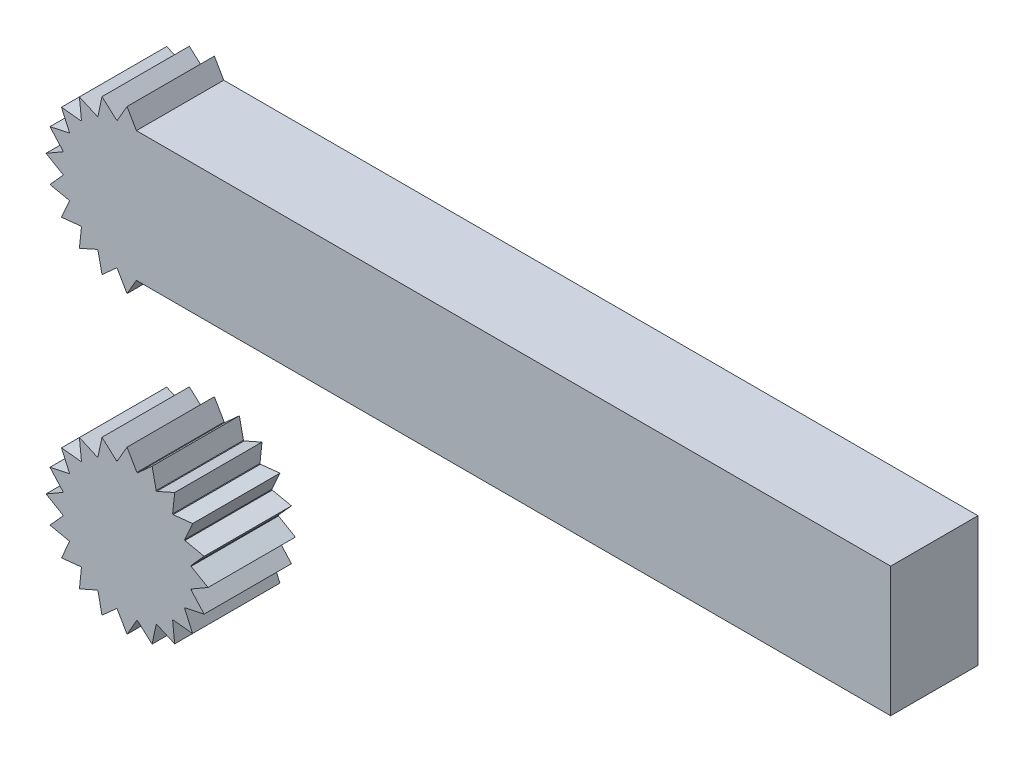
from build123d import *

# Parameters (mm, degrees)
IZIM1_W                     = 174.879
IZIM1_H                     = 29.68625
Y_KSEKLIK_EKSTR_ZYON1_DEPTH = 20
IZIM2_R                     = 14.843125
Y_KSEKLIK_EKSTR_ZYON5_DEPTH = 20


with BuildPart() as part:
    # Çizim1 → Yükseklik-Ekstrüzyon1 (new body)
    with BuildSketch(Plane.XY):
        with Locations((17.724325704, 8.366125)):
            Rectangle(IZIM1_W, IZIM1_H)
    extrude(amount=Y_KSEKLIK_EKSTR_ZYON1_DEPTH)

    # Çizim2 → Yükseklik-Ekstrüzyon5 (add, through all)
    with BuildSketch(Plane.XY.offset(20)):
        with Locations((-69.715174296, -59.190786916)):
            Circle(IZIM2_R)
        with BuildLine():
            Line((-75.450089767, -76.841041848), (-72.115481735, -73.83854729))
            ThreePointArc((-72.115481735, -73.83854729), (-74.30195217, -73.30743767), (-76.383022313, -72.451939302))
            Line((-76.383022313, -72.451939302), (-75.450089767, -76.841041848))
        make_face()
        with BuildLine():
            ThreePointArc((-67.471595442, -73.863370659), (-69.715174296, -74.033911916), (-71.95875315, -73.863370659))
            Line((-71.95875315, -73.863370659), (-69.715174296, -77.749363225))
            Line((-69.715174296, -77.749363225), (-67.471595442, -73.863370659))
        make_face()
        with BuildLine():
            ThreePointArc((-63.047326279, -72.451939302), (-65.128396421, -73.30743767), (-67.314866857, -73.83854729))
            Line((-67.314866857, -73.83854729), (-63.980258825, -76.841041848))
            Line((-63.980258825, -76.841041848), (-63.047326279, -72.451939302))
        make_face()
        with BuildLine():
            ThreePointArc((-59.275752538, -69.742413953), (-60.990604323, -71.199127291), (-62.90593938, -72.379899078))
            Line((-62.90593938, -72.379899078), (-58.806716838, -74.204990541))
            Line((-58.806716838, -74.204990541), (-59.275752538, -69.742413953))
        make_face()
        with BuildLine():
            ThreePointArc((-56.526062134, -66.000021832), (-57.706833921, -67.915356889), (-59.163547259, -69.630208674))
            Line((-59.163547259, -69.630208674), (-54.700970671, -70.099244374))
            Line((-54.700970671, -70.099244374), (-56.526062134, -66.000021832))
        make_face()
        with BuildLine():
            ThreePointArc((-55.067413922, -61.591094355), (-55.598523542, -63.777564791), (-56.45402191, -65.858634933))
            Line((-56.45402191, -65.858634933), (-52.064919364, -64.925702387))
            Line((-52.064919364, -64.925702387), (-55.067413922, -61.591094355))
        make_face()
        with BuildLine():
            ThreePointArc((-54.872049296, -59.190786916), (-54.914746019, -60.315812515), (-55.042590553, -61.43436577))
            Line((-55.042590553, -61.43436577), (-51.156597987, -59.190786916))
            Line((-51.156597987, -59.190786916), (-55.042590553, -56.947208062))
            ThreePointArc((-55.042590553, -56.947208062), (-54.914746019, -58.065761317), (-54.872049296, -59.190786916))
        make_face()
        with BuildLine():
            ThreePointArc((-56.45402191, -52.522938899), (-55.598523542, -54.604009042), (-55.067413922, -56.790479477))
            Line((-55.067413922, -56.790479477), (-52.064919364, -53.455871445))
            Line((-52.064919364, -53.455871445), (-56.45402191, -52.522938899))
        make_face()
        with BuildLine():
            ThreePointArc((-59.163547259, -48.751365158), (-57.706833921, -50.466216943), (-56.526062134, -52.381552))
            Line((-56.526062134, -52.381552), (-54.700970671, -48.282329458))
            Line((-54.700970671, -48.282329458), (-59.163547259, -48.751365158))
        make_face()
        with BuildLine():
            ThreePointArc((-62.90593938, -46.001674754), (-60.990604323, -47.182446542), (-59.275752538, -48.63915988))
            Line((-59.275752538, -48.639159879), (-58.806716838, -44.176583291))
            Line((-58.806716838, -44.176583291), (-62.90593938, -46.001674754))
        make_face()
        with BuildLine():
            Line((-63.980258825, -41.540531985), (-67.314866857, -44.543026543))
            ThreePointArc((-67.314866857, -44.543026543), (-65.128396421, -45.074136163), (-63.047326279, -45.929634531))
            Line((-63.047326279, -45.929634531), (-63.980258825, -41.540531985))
        make_face()
        with BuildLine():
            Line((-69.715174296, -40.632210608), (-71.95875315, -44.518203173))
            ThreePointArc((-71.95875315, -44.518203173), (-69.715174296, -44.347661916), (-67.471595442, -44.518203173))
            Line((-67.471595442, -44.518203173), (-69.715174296, -40.632210608))
        make_face()
        with BuildLine():
            Line((-75.450089767, -41.540531985), (-76.383022313, -45.929634531))
            ThreePointArc((-76.383022313, -45.929634531), (-74.30195217, -45.074136163), (-72.115481735, -44.543026543))
            Line((-72.115481735, -44.543026543), (-75.450089767, -41.540531985))
        make_face()
        with BuildLine():
            Line((-80.623631754, -44.176583291), (-80.154596054, -48.639159879))
            ThreePointArc((-80.154596054, -48.639159879), (-78.439744269, -47.182446542), (-76.524409212, -46.001674754))
            Line((-76.524409212, -46.001674754), (-80.623631754, -44.176583291))
        make_face()
        with BuildLine():
            Line((-84.729377921, -48.282329458), (-82.904286458, -52.381552))
            ThreePointArc((-82.904286458, -52.381552), (-81.72351467, -50.466216943), (-80.266801332, -48.751365158))
            Line((-80.266801332, -48.751365158), (-84.729377921, -48.282329458))
        make_face()
        with BuildLine():
            Line((-87.365429227, -53.455871445), (-84.362934669, -56.790479477))
            ThreePointArc((-84.362934669, -56.790479477), (-83.831825049, -54.604009042), (-82.976326681, -52.522938899))
            Line((-82.976326681, -52.522938899), (-87.365429227, -53.455871445))
        make_face()
        with BuildLine():
            Line((-88.273750604, -59.190786916), (-84.387758039, -61.43436577))
            ThreePointArc((-84.387758039, -61.43436577), (-84.558299296, -59.190786916), (-84.387758039, -56.947208062))
            Line((-84.387758039, -56.947208062), (-88.273750604, -59.190786916))
        make_face()
        with BuildLine():
            Line((-87.365429227, -64.925702387), (-82.976326681, -65.858634933))
            ThreePointArc((-82.976326681, -65.858634933), (-83.831825049, -63.777564791), (-84.362934669, -61.591094355))
            Line((-84.362934669, -61.591094355), (-87.365429227, -64.925702387))
        make_face()
        with BuildLine():
            Line((-84.729377921, -70.099244374), (-80.266801332, -69.630208674))
            ThreePointArc((-80.266801332, -69.630208674), (-81.72351467, -67.915356889), (-82.904286458, -66.000021832))
            Line((-82.904286458, -66.000021832), (-84.729377921, -70.099244374))
        make_face()
        with BuildLine():
            Line((-80.623631754, -74.204990541), (-76.524409212, -72.379899078))
            ThreePointArc((-76.524409212, -72.379899078), (-78.439744269, -71.199127291), (-80.154596054, -69.742413953))
            Line((-80.154596054, -69.742413953), (-80.623631754, -74.204990541))
        make_face()
        with BuildLine():
            Line((-69.715174296, -6.477), (-69.715174296, 23.20925))
            ThreePointArc((-69.715174296, 23.20925), (-70.840199895, 23.166553276), (-71.95875315, 23.038708743))
            ThreePointArc((-71.95875315, 23.038708743), (-72.037150615, 23.0265065), (-72.115481735, 23.013885374))
            ThreePointArc((-72.115481735, 23.013885374), (-74.30195217, 22.482775753), (-76.383022313, 21.627277385))
            ThreePointArc((-76.383022313, 21.627277385), (-76.453812032, 21.591446214), (-76.524409212, 21.555237162))
            ThreePointArc((-76.524409212, 21.555237162), (-78.439744269, 20.374465375), (-80.154596054, 18.917752037))
            ThreePointArc((-80.154596054, 18.917752037), (-80.210848637, 18.861799341), (-80.266801332, 18.805546758))
            ThreePointArc((-80.266801332, 18.805546758), (-81.72351467, 17.090694973), (-82.904286458, 15.175359916))
            ThreePointArc((-82.904286458, 15.175359916), (-82.94049551, 15.104762736), (-82.976326681, 15.033973017))
            ThreePointArc((-82.976326681, 15.033973017), (-83.831825049, 12.952902875), (-84.362934669, 10.766432439))
            ThreePointArc((-84.362934669, 10.766432439), (-84.375555796, 10.688101319), (-84.387758039, 10.609703854))
            ThreePointArc((-84.387758039, 10.609703854), (-84.558299296, 8.366125), (-84.387758039, 6.122546146))
            ThreePointArc((-84.387758039, 6.122546146), (-84.375555796, 6.044148681), (-84.362934669, 5.965817561))
            ThreePointArc((-84.362934669, 5.965817561), (-83.831825049, 3.779347125), (-82.976326681, 1.698276983))
            ThreePointArc((-82.976326681, 1.698276983), (-82.94049551, 1.627487264), (-82.904286458, 1.556890084))
            ThreePointArc((-82.904286458, 1.556890084), (-81.72351467, -0.358444973), (-80.266801332, -2.073296758))
            ThreePointArc((-80.266801332, -2.073296758), (-80.210848637, -2.129549342), (-80.154596054, -2.185502037))
            ThreePointArc((-80.154596054, -2.185502037), (-78.439744269, -3.642215375), (-76.524409212, -4.822987162))
            ThreePointArc((-76.524409212, -4.822987162), (-76.453812032, -4.859196214), (-76.383022313, -4.895027385))
            ThreePointArc((-76.383022313, -4.895027385), (-74.30195217, -5.750525753), (-72.115481735, -6.281635374))
            ThreePointArc((-72.115481735, -6.281635374), (-72.037150615, -6.2942565), (-71.95875315, -6.306458743))
            ThreePointArc((-71.95875315, -6.306458743), (-70.840199895, -6.434303276), (-69.715174296, -6.477))
        make_face()
        with BuildLine():
            Line((-75.450089767, -9.284129931), (-72.115481735, -6.281635374))
            ThreePointArc((-72.115481735, -6.281635374), (-74.30195217, -5.750525753), (-76.383022313, -4.895027385))
            Line((-76.383022313, -4.895027385), (-75.450089767, -9.284129931))
        make_face()
        with BuildLine():
            Line((-67.570057483, -6.477), (-69.715174296, -6.477))
            ThreePointArc((-69.715174296, -6.477), (-70.840199895, -6.434303276), (-71.95875315, -6.306458743))
            Line((-71.95875315, -6.306458743), (-69.715174296, -10.192451309))
            Line((-69.715174296, -10.192451309), (-67.570057483, -6.477))
        make_face()
        with BuildLine():
            Line((-80.623631754, -6.648078625), (-76.524409212, -4.822987162))
            ThreePointArc((-76.524409212, -4.822987162), (-78.439744269, -3.642215375), (-80.154596054, -2.185502037))
            Line((-80.154596054, -2.185502037), (-80.623631754, -6.648078625))
        make_face()
        with BuildLine():
            Line((-84.729377921, -2.542332458), (-80.266801332, -2.073296758))
            ThreePointArc((-80.266801332, -2.073296758), (-81.72351467, -0.358444973), (-82.904286458, 1.556890084))
            Line((-82.904286458, 1.556890084), (-84.729377921, -2.542332458))
        make_face()
        with BuildLine():
            Line((-87.365429227, 2.631209529), (-82.976326681, 1.698276983))
            ThreePointArc((-82.976326681, 1.698276983), (-83.831825049, 3.779347125), (-84.362934669, 5.965817561))
            Line((-84.362934669, 5.965817561), (-87.365429227, 2.631209529))
        make_face()
        with BuildLine():
            ThreePointArc((-84.387758039, 6.122546146), (-84.558299296, 8.366125), (-84.387758039, 10.609703854))
            Line((-84.387758039, 10.609703854), (-88.273750604, 8.366125))
            Line((-88.273750604, 8.366125), (-84.387758039, 6.122546146))
        make_face()
        with BuildLine():
            ThreePointArc((-84.362934669, 10.766432439), (-83.831825049, 12.952902875), (-82.976326681, 15.033973017))
            Line((-82.976326681, 15.033973017), (-87.365429227, 14.101040471))
            Line((-87.365429227, 14.101040471), (-84.362934669, 10.766432439))
        make_face()
        with BuildLine():
            ThreePointArc((-82.904286458, 15.175359916), (-81.72351467, 17.090694973), (-80.266801332, 18.805546758))
            Line((-80.266801332, 18.805546758), (-84.729377921, 19.274582458))
            Line((-84.729377921, 19.274582458), (-82.904286458, 15.175359916))
        make_face()
        with BuildLine():
            ThreePointArc((-80.154596054, 18.917752037), (-78.439744269, 20.374465375), (-76.524409212, 21.555237162))
            Line((-76.524409212, 21.555237162), (-80.623631754, 23.380328625))
            Line((-80.623631754, 23.380328625), (-80.154596054, 18.917752037))
        make_face()
        with BuildLine():
            ThreePointArc((-76.383022313, 21.627277385), (-74.30195217, 22.482775753), (-72.115481735, 23.013885374))
            Line((-72.115481735, 23.013885374), (-75.450089767, 26.016379931))
            Line((-75.450089767, 26.016379931), (-76.383022313, 21.627277385))
        make_face()
        with BuildLine():
            Line((-69.715174296, 23.20925), (-67.570057483, 23.20925))
            Line((-67.570057483, 23.20925), (-69.715174296, 26.924701309))
            Line((-69.715174296, 26.924701309), (-71.95875315, 23.038708743))
            ThreePointArc((-71.95875315, 23.038708743), (-70.840199895, 23.166553276), (-69.715174296, 23.20925))
        make_face()
    extrude(amount=-Y_KSEKLIK_EKSTR_ZYON5_DEPTH)


with BuildPart() as y_kseklik_ekstr_zyon5_piece_1:
    # of the separate pieces the step leaves, piece 1, a body of its own (y_kseklik_ekstr_zyon5_pieces)
    add(part.part.solids().sort_by_distance((-67.570057483, -6.477, 0))[0])


with BuildPart() as y_kseklik_ekstr_zyon5_piece_2:
    # of the separate pieces the step leaves, piece 2, a body of its own (y_kseklik_ekstr_zyon5_pieces)
    add(part.part.solids().sort_by_distance((-76.383022313, -72.451939302, 20))[0])


solid = Compound([y_kseklik_ekstr_zyon5_piece_1.part, y_kseklik_ekstr_zyon5_piece_2.part])
